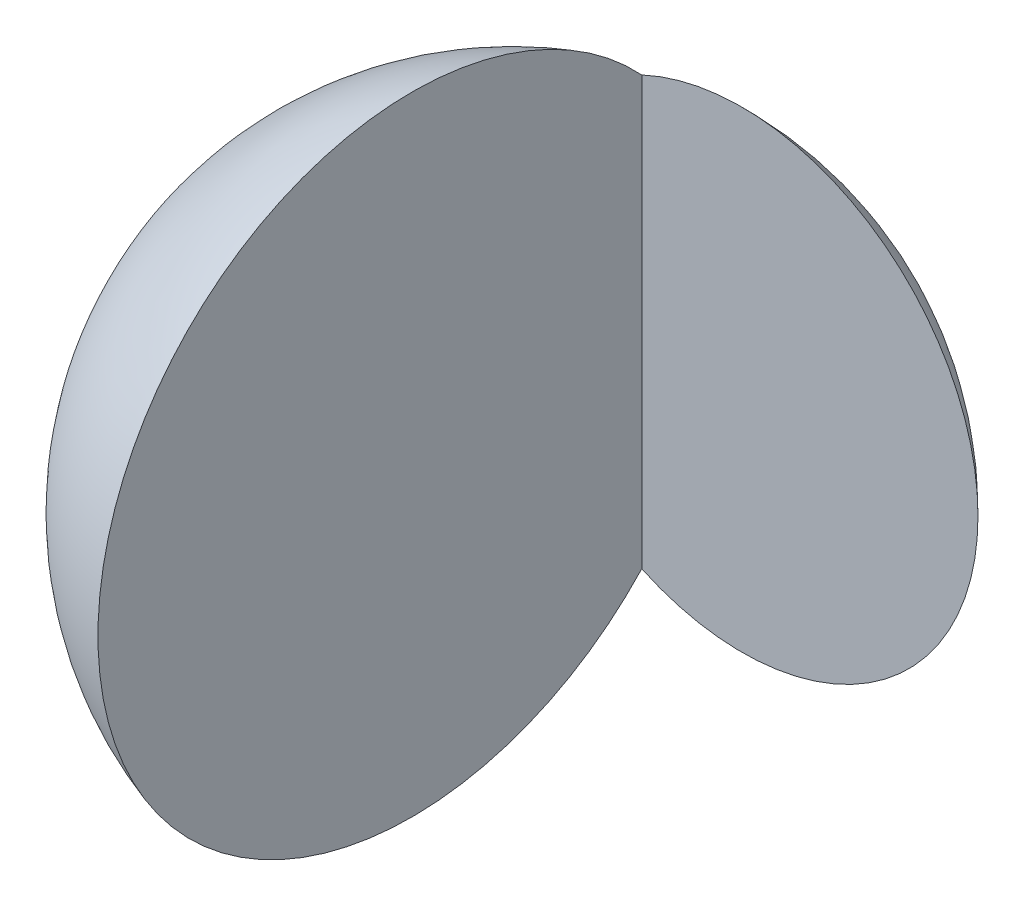
from build123d import *

# Parameters (mm, degrees)
CUT_EXTRUDE1_DEPTH      = 48.847340101
CUT_EXTRUDE1_DEPTH_BACK = 48.847340101
SKETCH2_W               = 75.893427602
SKETCH2_H               = 81.233977421


with BuildPart() as part:
    # Sketch1 → Revolve1 (revolve)
    with BuildSketch(Plane(origin=(0, 0, 0), x_dir=(1, 0, 0), z_dir=(0, 1, 0))):
        with BuildLine():
            Line((-27.624674687, 0), (27.624674687, 0))
            ThreePointArc((27.624674687, 0), (0, 27.624674687), (-27.624674687, 0))
        make_face()
    revolve(axis=Axis((-27.624674687, 0, 0), (1, 0, 0)))

    # Sketch2 → Cut-Extrude1 (cut, two sides: drawn at the far end of the back side and taken through both)
    with BuildSketch(Plane(origin=(0, 0, 0), x_dir=(1, 0, 0), z_dir=(0, 1, 0)).offset(-CUT_EXTRUDE1_DEPTH_BACK)):
        with Locations((29.553196242, -21.347370523)):
            Rectangle(SKETCH2_W, SKETCH2_H)
    extrude(amount=CUT_EXTRUDE1_DEPTH + CUT_EXTRUDE1_DEPTH_BACK, mode=Mode.SUBTRACT)


solid = part.part
